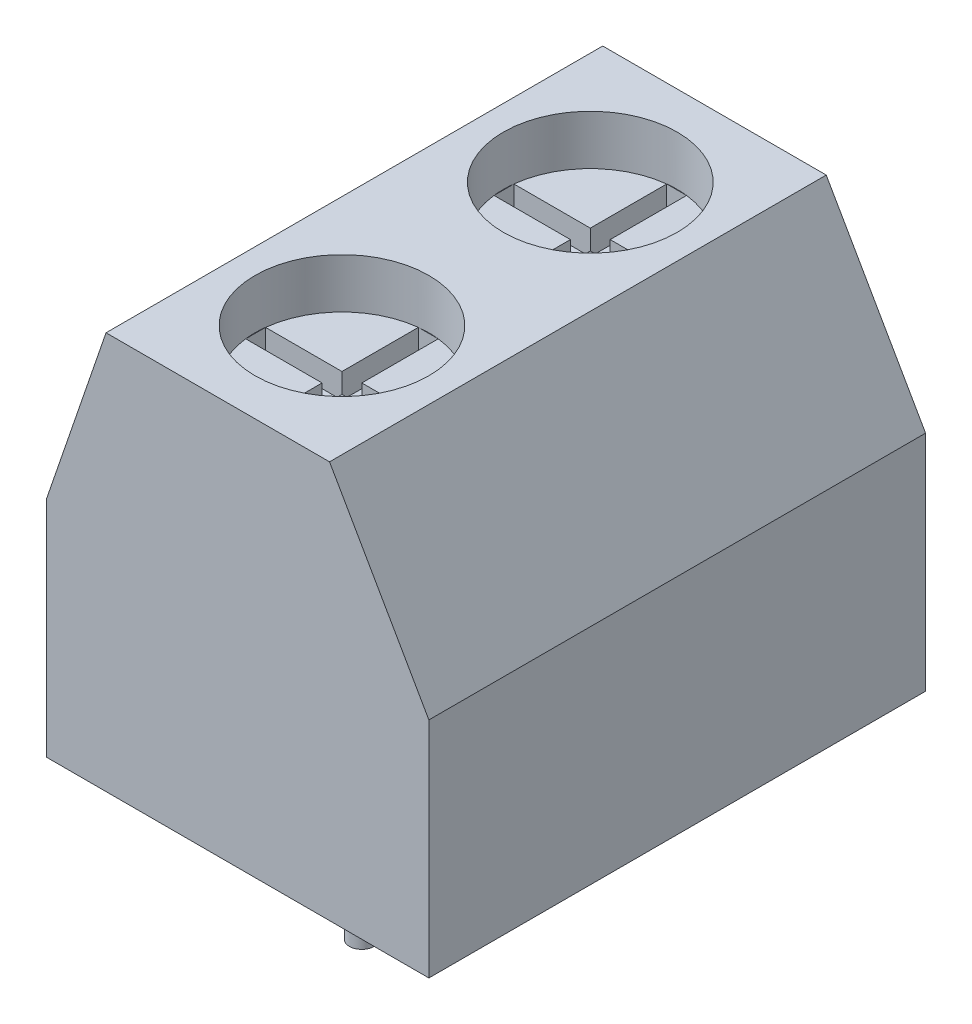
from build123d import *

# Parameters (mm, degrees)
BOSS_EXTRU_2_DEPTH      = 10
ESQUISSE2_W             = 4.4
ESQUISSE2_H             = 3.4
ENL_V_MAT_EXTRU_1_DEPTH = 6
ESQUISSE3_R             = 0.25
BOSS_EXTRU_3_DEPTH      = 2.5
ESQUISSE5_R             = 1.75
ENL_V_MAT_EXTRU_2_DEPTH = 1
ESQUISSE6_W             = 1.538533865
ESQUISSE6_H             = 0.4
ESQUISSE6_W_2           = 0.4
ESQUISSE6_H_2           = 1.538533865
ENL_V_MAT_EXTRU_3_DEPTH = 0.5


with BuildPart() as part:
    # Esquisse1 → Boss.-Extru.2 (new body)
    with BuildSketch(Plane.XY):
        Polygon((-7.7, 0), (0, 0), (0, 4.5), (-2, 8), (-6.5, 8), (-7.7, 4.5), align=None)
    extrude(amount=BOSS_EXTRU_2_DEPTH)

    # Esquisse2 → Enlèv. mat.-Extru.1 (cut)
    with BuildSketch(Plane.ZY.offset(7.7)):
        with Locations((2.6, 2.1)):
            Rectangle(ESQUISSE2_W, ESQUISSE2_H)
        with Locations((7.4, 2.1)):
            Rectangle(ESQUISSE2_W, ESQUISSE2_H)
    extrude(amount=-ENL_V_MAT_EXTRU_1_DEPTH, mode=Mode.SUBTRACT)

    # Esquisse3 → Boss.-Extru.3 (add)
    with BuildSketch(Plane(origin=(0, 0, 0), x_dir=(-1, 0, 0), z_dir=(0, -1, 0))):
        with Locations(Location((3.85, -2.5, 0), (0, 0, 90))):
            Circle(ESQUISSE3_R)
        with Locations(Location((3.85, -7.5, 0), (0, 0, 90))):
            Circle(ESQUISSE3_R)
    extrude(amount=BOSS_EXTRU_3_DEPTH)

    # Esquisse5 → Enlèv. mat.-Extru.2 (cut)
    with BuildSketch(Plane(origin=(0, 8, 0), x_dir=(1, 0, 0), z_dir=(0, 1, 0))):
        with Locations(Location((-4.25, -7.5, 0), (0, 0, 180))):
            Circle(ESQUISSE5_R)
        with Locations(Location((-4.25, -2.5, 0), (0, 0, 180))):
            Circle(ESQUISSE5_R)
    extrude(amount=-ENL_V_MAT_EXTRU_2_DEPTH, mode=Mode.SUBTRACT)

    # Esquisse6 → Enlèv. mat.-Extru.3 (cut)
    with BuildSketch(Plane(origin=(0, 7, 0), x_dir=(1, 0, 0), z_dir=(0, 1, 0))):
        with Locations((-5.219266933, -7.5)):
            Rectangle(ESQUISSE6_W, ESQUISSE6_H)
        with Locations((-4.25, -8.469266933)):
            Rectangle(ESQUISSE6_W_2, ESQUISSE6_H_2)
        with Locations((-3.280733067, -7.5)):
            Rectangle(ESQUISSE6_W, ESQUISSE6_H)
        with Locations((-4.25, -6.530733067)):
            Rectangle(ESQUISSE6_W_2, ESQUISSE6_H_2)
        with Locations((-4.25, -7.5)):
            Rectangle(ESQUISSE6_W_2, ESQUISSE6_H)
        with Locations((-4.25, -3.469266933)):
            Rectangle(ESQUISSE6_W_2, ESQUISSE6_H_2)
        with Locations((-4.25, -2.5)):
            Rectangle(ESQUISSE6_W_2, ESQUISSE6_H)
        with Locations((-3.280733067, -2.5)):
            Rectangle(ESQUISSE6_W, ESQUISSE6_H)
        with Locations((-4.25, -1.530733068)):
            Rectangle(ESQUISSE6_W_2, ESQUISSE6_H_2)
        with Locations((-5.219266933, -2.5)):
            Rectangle(ESQUISSE6_W, ESQUISSE6_H)
    extrude(amount=-ENL_V_MAT_EXTRU_3_DEPTH, mode=Mode.SUBTRACT)


solid = part.part
